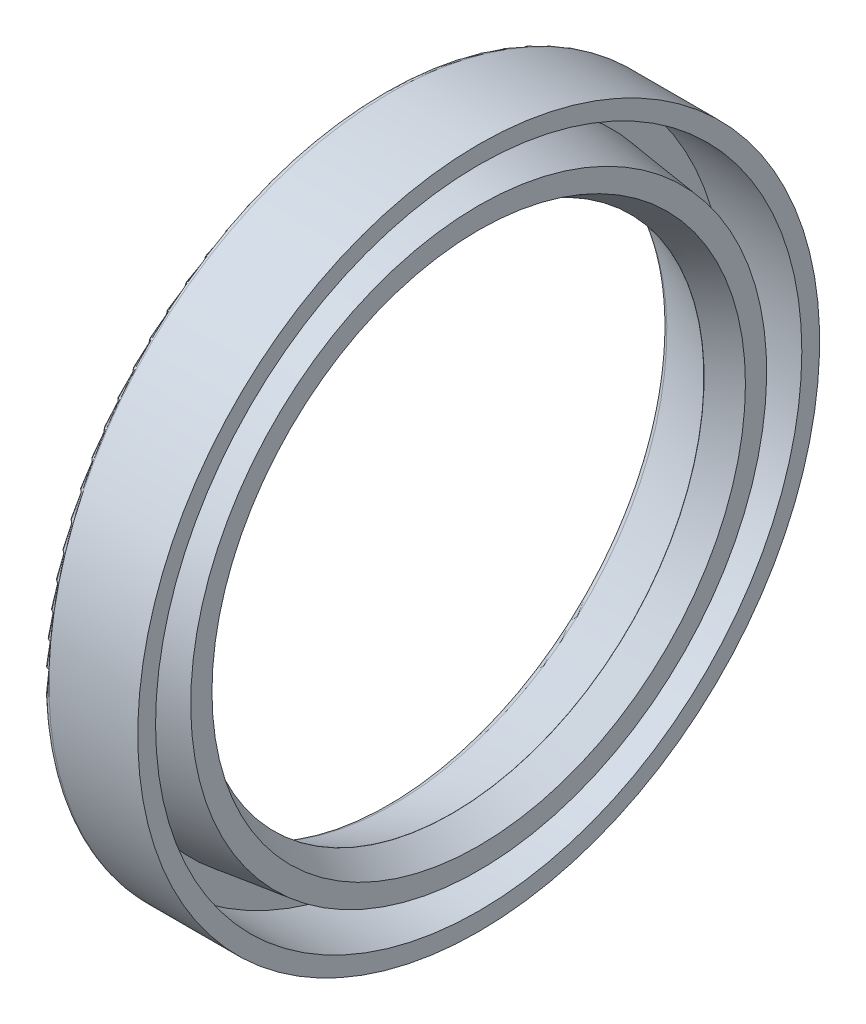
from build123d import *


with BuildPart() as part:
    # Sketch1 → Revolve2 (revolve)
    with BuildSketch(Plane.XY):
        with BuildLine():
            Line((0.9025, 9.714192053), (0.9025, 8.997599754))
            Line((0.9025, 8.997599754), (0.005, 8.5))
            Line((0.005, 8.5), (0, 8.5))
            Line((0, 8.5), (-1.96898625, 9.218913515))
            ThreePointArc((-1.96898625, 9.218913515), (-2.207221323, 9.402005642), (-2.2975, 9.688586237))
            Line((-2.2975, 9.688586237), (-2.2975, 11.3))
            ThreePointArc((-2.2975, 11.3), (-2.238921356, 11.441421356), (-2.0975, 11.5))
            Line((-2.0975, 11.5), (0.9025, 11.5))
            Line((0.9025, 11.5), (0.9025, 10.9))
            Line((0.9025, 10.9), (-1.6975, 10.9))
            Line((-1.6975, 10.9), (-1.6975, 10.039192053))
            Line((-1.6975, 10.039192053), (0.9025, 9.714192053))
        make_face()
    revolve(axis=Axis((0, 0, 0), (-1, 0, 0)))


solid = part.part
